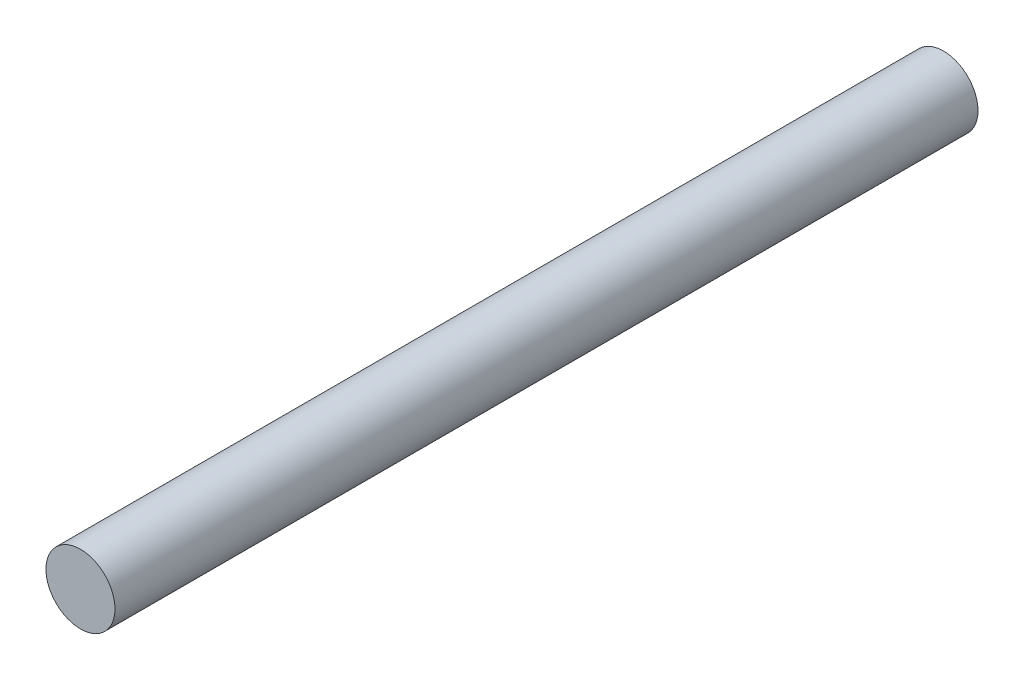
from build123d import *

# Parameters (mm, degrees)
SKETCH2_R           = 4
BOSS_EXTRUDE1_DEPTH = 100


with BuildPart() as part:
    # Sketch2 → Boss-Extrude1 (new body)
    with BuildSketch(Plane.XY):
        Circle(SKETCH2_R)
    extrude(amount=-BOSS_EXTRUDE1_DEPTH)


solid = part.part
